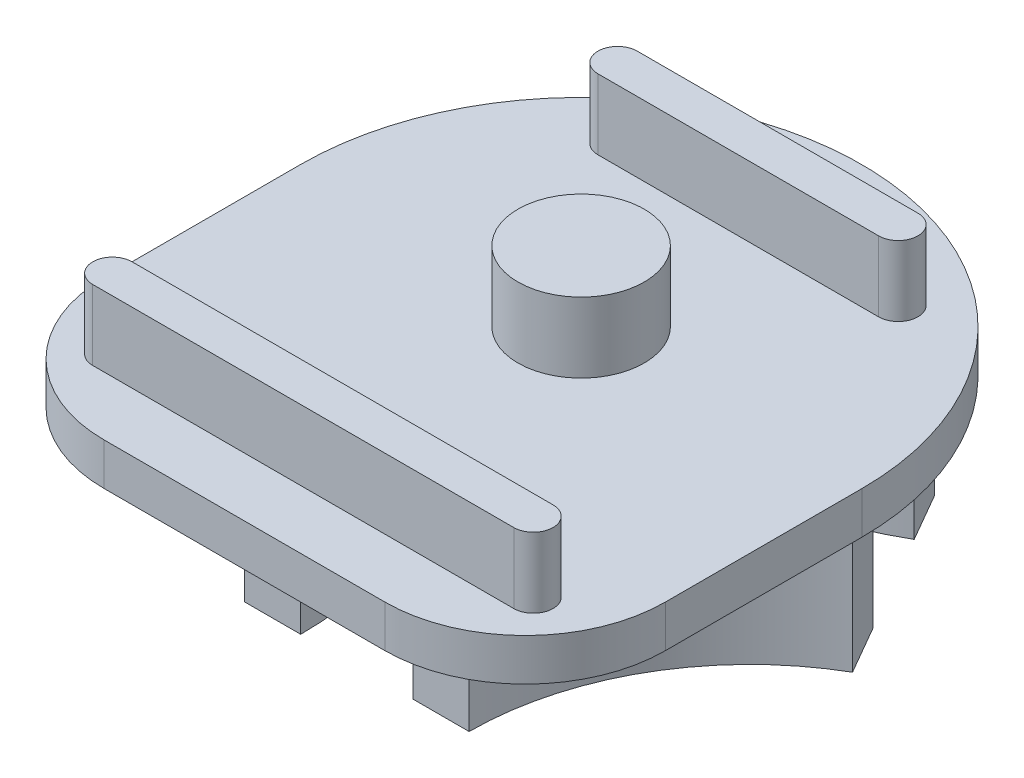
from build123d import *

# Parameters (mm, degrees)
SKETCH1_R             = 24
SKETCH1_R_2           = 20
BOSS_EXTRUDE1_DEPTH   = 10
BOSS_EXTRUDE1_2_DEPTH = 10
BOSS_EXTRUDE1_3_DEPTH = 10
BOSS_EXTRUDE1_4_DEPTH = 10
BOSS_EXTRUDE2_DEPTH   = 3
SKETCH3_W             = 121.220550743
SKETCH3_H             = 101.763820318
CUT_EXTRUDE1_DEPTH    = 10
SKETCH4_R             = 4.5
BOSS_EXTRUDE4_DEPTH   = 5
FILLET1_R             = 10


with BuildPart() as part:
    # Sketch1 → Boss-Extrude1 (new body)
    with BuildSketch(Plane(origin=(0, 0, 0), x_dir=(1, 0, 0), z_dir=(0, 1, 0))):
        with Locations(Location((-28, -48.497422612, 0), (0, 0, 270))):
            Circle(SKETCH1_R)
        with Locations(Location((-28, -48.497422612, 0), (0, 0, 270))):
            Circle(SKETCH1_R_2, mode=Mode.SUBTRACT)
    extrude(amount=BOSS_EXTRUDE1_DEPTH)



with BuildPart() as body_2:
    # Sketch1 → Boss-Extrude1 2 (new body)
    with BuildSketch(Plane(origin=(0, 0, 0), x_dir=(1, 0, 0), z_dir=(0, 1, 0))):
        with Locations(Location((0, 0, 0), (0, 0, 270))):
            Circle(SKETCH1_R)
        with Locations(Location((0, 0, 0), (0, 0, 270))):
            Circle(SKETCH1_R_2, mode=Mode.SUBTRACT)
    extrude(amount=BOSS_EXTRUDE1_2_DEPTH)


with BuildPart() as body_3:
    # Sketch1 → Boss-Extrude1 3 (new body)
    with BuildSketch(Plane(origin=(0, 0, 0), x_dir=(1, 0, 0), z_dir=(0, 1, 0))):
        with Locations(Location((28, -48.497422612, 0), (0, 0, 270))):
            Circle(SKETCH1_R)
        with Locations(Location((28, -48.497422612, 0), (0, 0, 270))):
            Circle(SKETCH1_R_2, mode=Mode.SUBTRACT)
    extrude(amount=BOSS_EXTRUDE1_3_DEPTH)


with BuildPart() as body_4:
    # Sketch1 → Boss-Extrude1 4 (new body)
    with BuildSketch(Plane(origin=(0, 0, 0), x_dir=(1, 0, 0), z_dir=(0, 1, 0))):
        with BuildLine():
            ThreePointArc((4.672620947, -29.633876113), (2.019237886, -33.497422612), (0, -37.727092998))
            ThreePointArc((0, -37.727092998), (-2.019237886, -33.497422612), (-4.672620947, -29.633876113))
            ThreePointArc((-4.672620947, -29.633876113), (0, -30), (4.672620947, -29.633876113))
        make_face()
    extrude(amount=BOSS_EXTRUDE1_4_DEPTH)


with BuildPart() as part_1:
    add(part.part)

    add(body_2.part)  # Boss-Extrude2 merges body 2

    add(body_3.part)  # Boss-Extrude2 merges body 3

    add(body_4.part)  # Boss-Extrude2 merges body 4
    # Sketch2 → Boss-Extrude2 (add)
    with BuildSketch(Plane(origin=(0, 10, 0), x_dir=(1, 0, 0), z_dir=(0, 1, 0))):
        with BuildLine():
            Line((-20, -32.516950024), (-20, -56.505922275))
            Line((-20, -56.505922275), (20, -56.505922275))
            Line((20, -56.505922275), (20, -32.516950024))
            ThreePointArc((20, -32.516950024), (0, -12.516950024), (-20, -32.516950024))
        make_face()
    extrude(amount=BOSS_EXTRUDE2_DEPTH)

    # Sketch3 → Cut-Extrude1 (cut)
    with BuildSketch(Plane.XZ):
        with Locations((1.216045651, 23.416680071)):
            Rectangle(SKETCH3_W, SKETCH3_H)
        Polygon((0, 0), (28, 48.497422612), (-28, 48.497422612), align=None, mode=Mode.SUBTRACT)
    extrude(amount=-CUT_EXTRUDE1_DEPTH, mode=Mode.SUBTRACT)

    # Sketch4 → Boss-Extrude4 (add)
    with BuildSketch(Plane(origin=(0, 13, 0), x_dir=(1, 0, 0), z_dir=(0, 1, 0))):
        with Locations(Location((0, -32.516950024, 0), (0, 0, 270))):
            Circle(SKETCH4_R)
        with BuildLine():
            Line((-10, -18.516950024), (10, -18.516950024))
            ThreePointArc((10, -18.516950024), (11.4, -19.916950024), (10, -21.316950024))
            Line((10, -21.316950024), (-10, -21.316950024))
            ThreePointArc((-10, -21.316950024), (-11.4, -19.916950024), (-10, -18.516950024))
        make_face()
        with BuildLine():
            Line((-15, -49.516950024), (15, -49.516950024))
            ThreePointArc((15, -49.516950024), (16.4, -50.916950024), (15, -52.316950024))
            Line((15, -52.316950024), (-15, -52.316950024))
            ThreePointArc((-15, -52.316950024), (-16.4, -50.916950024), (-15, -49.516950024))
        make_face()
    extrude(amount=BOSS_EXTRUDE4_DEPTH)

    # Fillet1
    fillet1_edges = [part_1.edges().sort_by_distance(p)[0] for p in [
        (-20, 11.5, 56.505922275),
        (20, 11.5, 56.505922275),
    ]]
    fillet(fillet1_edges, radius=FILLET1_R)


solid = part_1.part
